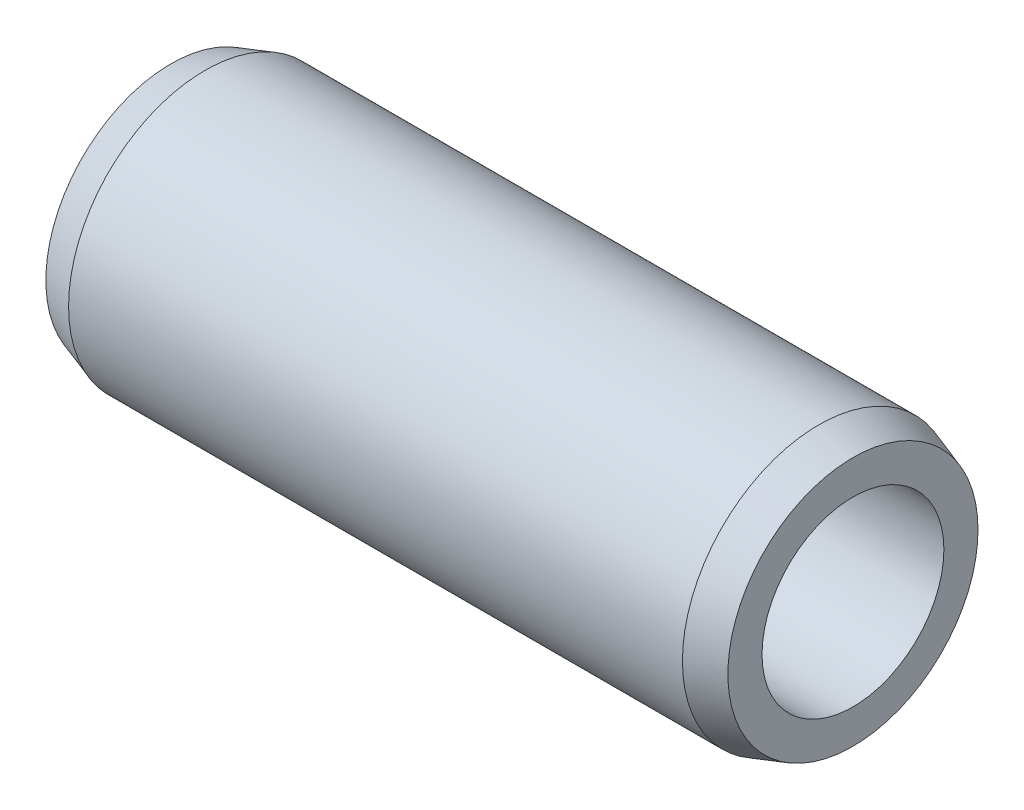
from build123d import *
from OCP.BRepFilletAPI import BRepFilletAPI_MakeChamfer

# Parameters (mm, degrees)
SKETCH1_R           = 6
SKETCH1_R_2         = 4
BOSS_EXTRUDE1_DEPTH = 30
CHAMFER2_SIZE       = 0.5
CHAMFER2_SIZE2      = 1.5


with BuildPart() as part:
    # Sketch1 → Boss-Extrude1 (new body)
    with BuildSketch(Plane(origin=(0, 0, 0), x_dir=(0, 0, -1), z_dir=(1, 0, 0))):
        Circle(SKETCH1_R)
        Circle(SKETCH1_R_2, mode=Mode.SUBTRACT)
    extrude(amount=BOSS_EXTRUDE1_DEPTH)

    # Chamfer2: one chamfer whose edges measure the first distance from different faces: ONE call of the kernel's chamfer builder (chamfer() names one face for all edges)
    chamfer2_edges_1 = [part.edges().sort_by_distance(p)[0] for p in [
        (0, 0, 6),
    ]]
    chamfer2_side_1 = [part.faces().sort_by_distance(p)[0] for p in [
        (0, 0, 5.830294373),
    ]]
    chamfer2_edges_2 = [part.edges().sort_by_distance(p)[0] for p in [
        (30, 0, 6),
    ]]
    chamfer2_side_2 = [part.faces().sort_by_distance(p)[0] for p in [
        (30, 0, 5.830294373),
    ]]
    chamfer2 = BRepFilletAPI_MakeChamfer(part.part.solid().wrapped)
    for e in chamfer2_edges_1:
        chamfer2.Add(CHAMFER2_SIZE, CHAMFER2_SIZE2, e.wrapped, chamfer2_side_1[0].wrapped)  # the first distance lies on this face
    for e in chamfer2_edges_2:
        chamfer2.Add(CHAMFER2_SIZE, CHAMFER2_SIZE2, e.wrapped, chamfer2_side_2[0].wrapped)  # the first distance lies on this face
    add(Compound.cast(chamfer2.Shape()), mode=Mode.REPLACE)


solid = part.part
